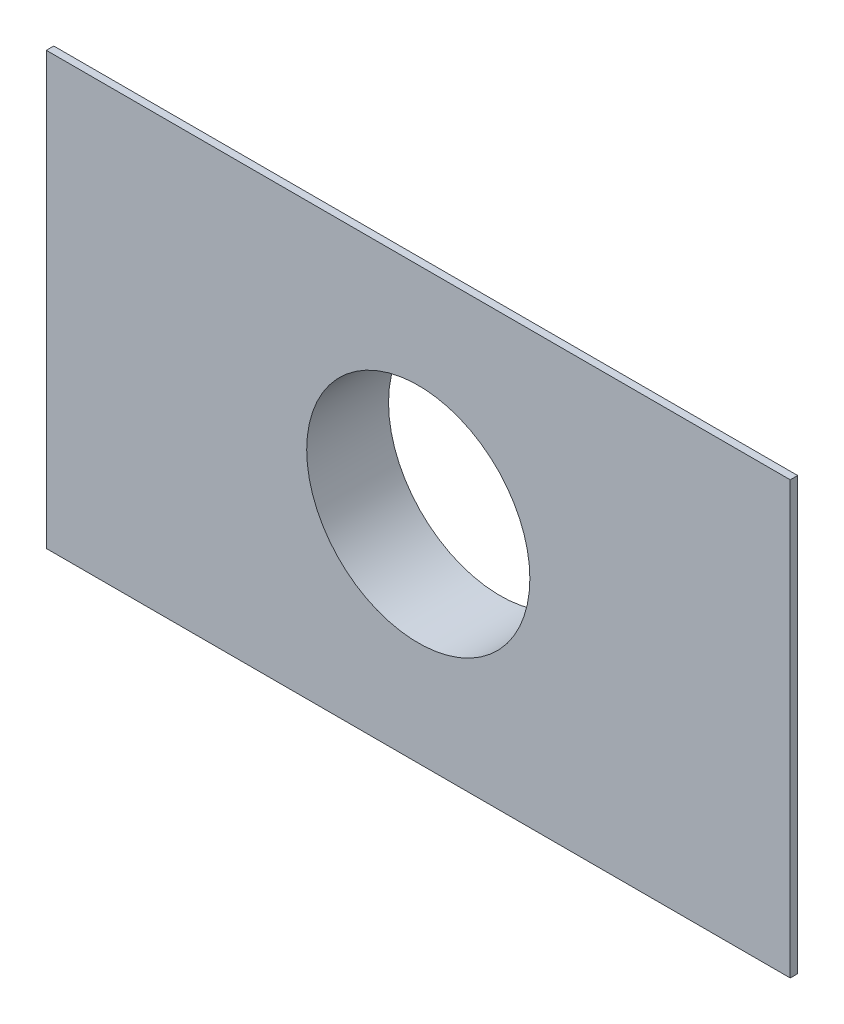
from build123d import *
from build123d.topology import SkipClean

# Parameters (mm, degrees)
SKETCH1_W           = 200
SKETCH1_H           = 116
SKETCH1_R           = 30
BOSS_EXTRUDE1_DEPTH = 2
BOSS_EXTRUDE2_START = 20
SKETCH2_R           = 32
SKETCH2_R_2         = 30
BOSS_EXTRUDE2_DEPTH = 20


with BuildPart() as part:
    # Sketch1 → Boss-Extrude1 (new body)
    with BuildSketch(Plane.XY):
        with Locations((-2.330233128, 44.845512274)):
            Rectangle(SKETCH1_W, SKETCH1_H)
        with Locations((-2.330233128, 44.845512274)):
            Circle(SKETCH1_R, mode=Mode.SUBTRACT)
    extrude(amount=BOSS_EXTRUDE1_DEPTH)

    # Sketch2 → Boss-Extrude2 (add)
    with SkipClean():  # the faces are left unmerged after this step: merging them gives an invalid solid
        with BuildSketch(Plane(origin=(0, 0, 0), x_dir=(-1, 0, 0), z_dir=(0, 0, -1)).offset(BOSS_EXTRUDE2_START)):
            with Locations(Location((2.330233128, 44.845512274, 0), (0, 0, 180))):
                Circle(SKETCH2_R)
            with Locations((2.330233128, 44.845512274)):
                Circle(SKETCH2_R_2, mode=Mode.SUBTRACT)
        extrude(amount=-BOSS_EXTRUDE2_DEPTH)


solid = part.part
